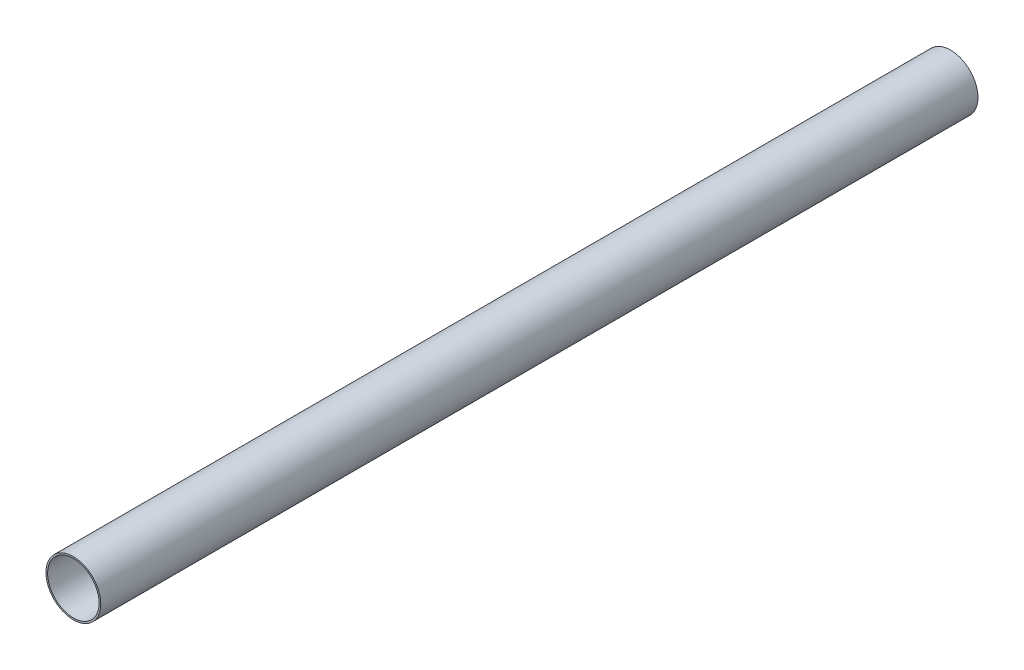
from build123d import *

# Parameters (mm, degrees)
SKETCH1_R           = 50
SKETCH1_R_2         = 47
BOSS_EXTRUDE1_DEPTH = 1600


with BuildPart() as part:
    # Sketch1 → Boss-Extrude1 (new body)
    with BuildSketch(Plane.XY):
        Circle(SKETCH1_R)
        Circle(SKETCH1_R_2, mode=Mode.SUBTRACT)
    extrude(amount=BOSS_EXTRUDE1_DEPTH)


solid = part.part
